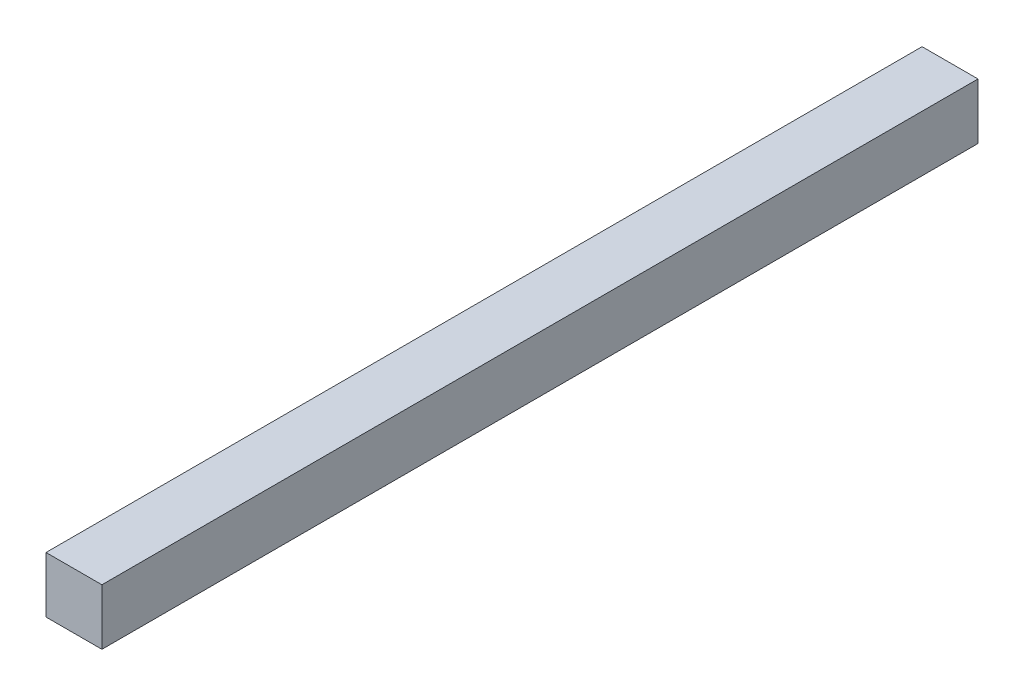
from build123d import *

# Parameters (mm, degrees)
SKETCH1_W           = 30
SKETCH1_H           = 30
BOSS_EXTRUDE1_DEPTH = 470


with BuildPart() as part:
    # Sketch1 → Boss-Extrude1 (new body)
    with BuildSketch(Plane.XY):
        with Locations((-4.576235094, 7.717206133)):
            Rectangle(SKETCH1_W, SKETCH1_H)
    extrude(amount=BOSS_EXTRUDE1_DEPTH)


solid = part.part
